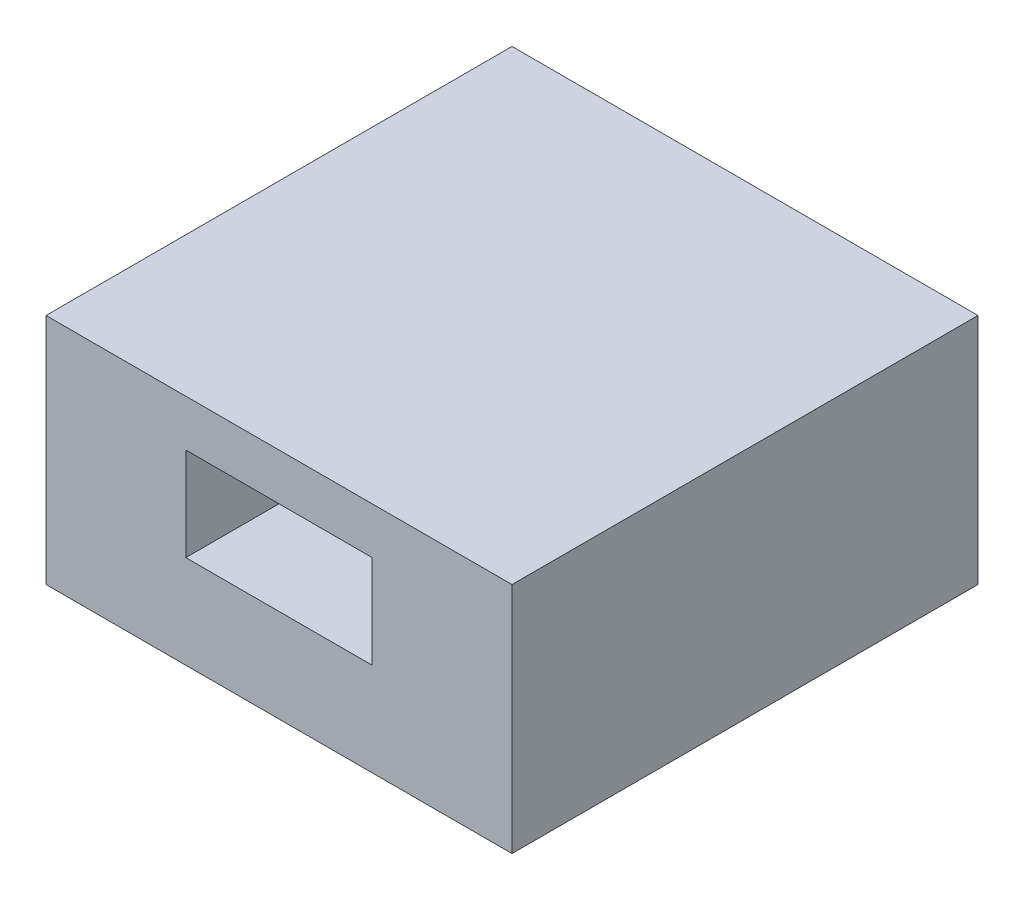
from build123d import *

# Parameters (mm, degrees)
SKETCH1_W           = 50
SKETCH1_H           = 50
BOSS_EXTRUDE1_DEPTH = 25
SKETCH2_W           = 20
SKETCH2_H           = 10
CUT_EXTRUDE1_DEPTH  = 50
SKETCH3_R           = 3
CUT_EXTRUDE2_DEPTH  = 10
CUT_EXTRUDE3_DEPTH  = 5


with BuildPart() as part:
    # Sketch1 → Boss-Extrude1 (new body)
    with BuildSketch(Plane(origin=(0, 0, 0), x_dir=(1, 0, 0), z_dir=(0, 1, 0))):
        with Locations((0, -25)):
            Rectangle(SKETCH1_W, SKETCH1_H)
    extrude(amount=BOSS_EXTRUDE1_DEPTH)

    # Sketch2 → Cut-Extrude1 (cut)
    with BuildSketch(Plane.XY.offset(50)):
        with Locations((0, 15)):
            Rectangle(SKETCH2_W, SKETCH2_H)
    extrude(amount=-CUT_EXTRUDE1_DEPTH, mode=Mode.SUBTRACT)

    # Sketch3 → Cut-Extrude2 (cut)
    with BuildSketch(Plane(origin=(0, 10, 0), x_dir=(1, 0, 0), z_dir=(0, 1, 0))):
        with Locations(Location((0, -8, 0), (0, 0, 270))):
            Circle(SKETCH3_R)
    extrude(amount=-CUT_EXTRUDE2_DEPTH, mode=Mode.SUBTRACT)

    # Sketch4 → Cut-Extrude3 (cut)
    with BuildSketch(Plane(origin=(0, 10, 0), x_dir=(1, 0, 0), z_dir=(0, 1, 0))):
        Polygon((2.886751346, -3), (-2.886751346, -3), (-5.773502692, -8), (-2.886751346, -13), (2.886751346, -13), (5.773502692, -8), align=None)
    extrude(amount=-CUT_EXTRUDE3_DEPTH, mode=Mode.SUBTRACT)


solid = part.part
